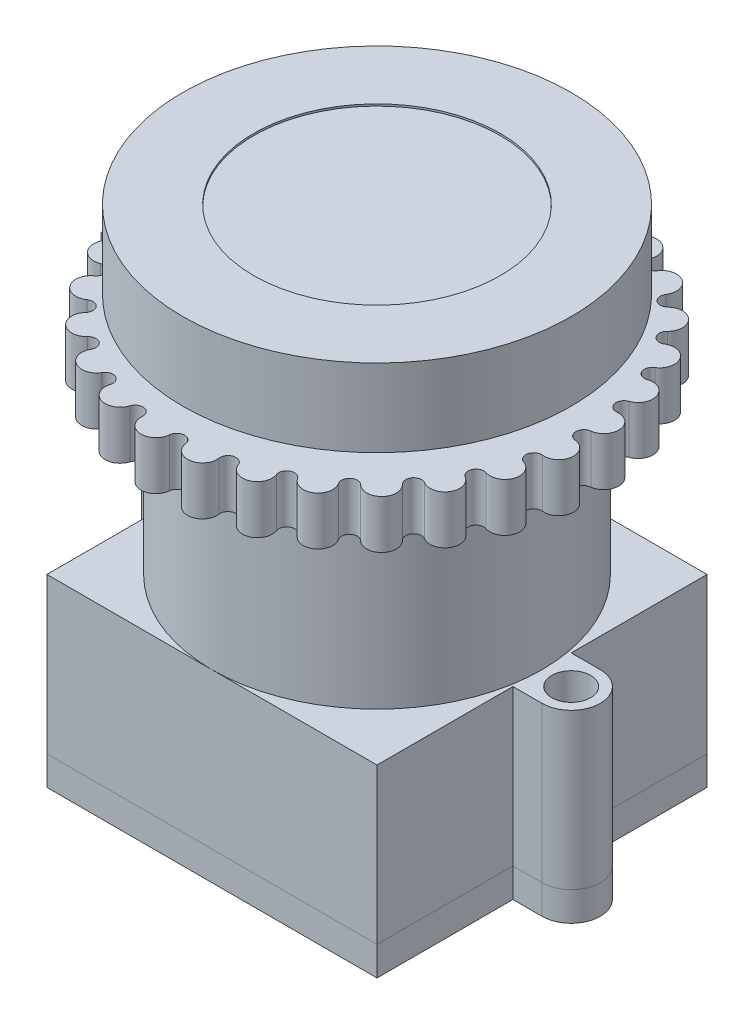
from build123d import *

# Parameters (mm, degrees)
BOSS_EXTRUDE1_DEPTH = 8
SKETCH3_R           = 8.500000018
BOSS_EXTRUDE2_DEPTH = 9
FILLET4_R           = 0.25
BOSS_EXTRUDE3_DEPTH = 2.5
SKETCH5_R           = 6.5
BOSS_EXTRUDE4_DEPTH = 1
SKETCH7_R           = 10
BOSS_EXTRUDE5_DEPTH = 4
SKETCH6_R           = 6.35
CUT_EXTRUDE2_DEPTH  = 0.1
BOSS_EXTRUDE6_DEPTH = 1.5
SKETCH2_R           = 1
CUT_EXTRUDE1_DEPTH  = 24.077752415


with BuildPart() as part:
    # Sketch1 → Boss-Extrude1 (new body)
    with BuildSketch(Plane(origin=(0, 0, 0), x_dir=(1, 0, 0), z_dir=(0, 1, 0))):
        with BuildLine():
            Line((8.500000018, -8.500000018), (8.500000018, -1.500000048))
            Line((8.500000018, -1.500000048), (10.000000066, -1.500000048))
            ThreePointArc((10.000000066, -1.500000048), (11.500000114, 0), (10.000000066, 1.500000048))
            Line((10.000000066, 1.500000048), (8.500000018, 1.500000048))
            Line((8.500000018, 1.500000048), (8.500000018, 8.500000018))
            Line((8.500000018, 8.500000018), (-8.500000018, 8.500000018))
            Line((-8.500000018, 8.500000018), (-8.500000018, 1.500000048))
            Line((-8.500000018, 1.500000048), (-10.000000066, 1.500000048))
            ThreePointArc((-10.000000066, 1.500000048), (-11.500000114, 0), (-10.000000066, -1.500000048))
            Line((-10.000000066, -1.500000048), (-8.500000018, -1.500000048))
            Line((-8.500000018, -1.500000048), (-8.500000018, -8.500000018))
            Line((-8.500000018, -8.500000018), (8.500000018, -8.500000018))
        make_face()
    extrude(amount=BOSS_EXTRUDE1_DEPTH)

    # Sketch3 → Boss-Extrude2 (add)
    with BuildSketch(Plane(origin=(0, 8, 0), x_dir=(1, 0, 0), z_dir=(0, 1, 0))):
        Circle(SKETCH3_R)
    extrude(amount=BOSS_EXTRUDE2_DEPTH)

    # Fillet4
    fillet4_edges = [part.edges().sort_by_distance(p)[0] for p in [
        (-8.500000018, 17, 0),
    ]]
    fillet(fillet4_edges, radius=FILLET4_R)

    # Sketch4 → Boss-Extrude3 (add)
    with BuildSketch(Plane(origin=(0, 17, 0), x_dir=(1, 0, 0), z_dir=(0, 1, 0))):
        with BuildLine():
            Line((-10.397042658, 3.347855978), (-10.861892381, 3.347855978))
            Line((-10.861892381, 3.347855978), (-10.861892381, -3.347855978))
            Line((-10.861892381, -3.347855978), (-10.397042658, -3.347855978))
            ThreePointArc((-10.397042658, -3.347855978), (-10.30482846, -3.409170816), (-10.325696234, -3.517925143))
            ThreePointArc((-10.325696234, -3.517925143), (-10.413698121, -4.478053525), (-9.490431715, -4.755848386))
            ThreePointArc((-9.490431715, -4.755848386), (-8.9781158, -4.935760929), (-9.10072321, -5.464725524))
            ThreePointArc((-9.10072321, -5.464725524), (-9.285999293, -6.526309611), (-8.224415206, -6.711585693))
            ThreePointArc((-8.224415206, -6.711585693), (-7.685190812, -6.775407106), (-7.689455387, -7.318378498))
            ThreePointArc((-7.689455387, -7.318378498), (-7.638692028, -8.394812928), (-6.562257599, -8.344049569))
            ThreePointArc((-6.562257599, -8.344049569), (-6.022097265, -8.288705798), (-5.907813595, -8.81953097))
            ThreePointArc((-5.907813595, -8.81953097), (-5.623455887, -9.858967689), (-4.584019167, -9.57460998))
            ThreePointArc((-4.584019167, -9.57460998), (-4.068940513, -9.402766741), (-3.841613241, -9.895877713))
            ThreePointArc((-3.841613241, -9.895877713), (-3.337357691, -10.848250718), (-2.384984686, -10.343995169))
            ThreePointArc((-2.384984686, -10.343995169), (-1.919797235, -10.063929543), (-1.590375914, -10.495574899))
            ThreePointArc((-1.590375914, -10.495574899), (-0.890510737, -11.315011738), (-0.071073897, -10.615146561))
            ThreePointArc((-0.071073897, -10.615146561), (0.321815911, -10.240348324), (0.737464217, -10.589737227))
            ThreePointArc((0.737464217, -10.589737227), (1.599228982, -11.236768515), (2.246260271, -10.375003749))
            ThreePointArc((2.246260271, -10.375003749), (2.547928318, -9.923525612), (3.029783294, -10.173829229))
            ThreePointArc((3.029783294, -10.173829229), (4.011939477, -10.61728975), (4.455399997, -9.635133567))
            ThreePointArc((4.455399997, -9.635133567), (4.651315997, -9.12872164), (5.176168388, -9.267883729))
            ThreePointArc((5.176168388, -9.267883729), (6.231408984, -9.486413552), (6.449938806, -8.431172955))
            ThreePointArc((6.449938806, -8.431172955), (6.530666175, -7.894219315), (7.07323569, -7.915536929))
            ThreePointArc((7.07323569, -7.915536929), (8.15073348, -7.898610241), (8.133806792, -6.821112451))
            ThreePointArc((8.133806792, -6.821112451), (8.095457176, -6.279480264), (8.629610154, -6.181926608))
            ThreePointArc((8.629610154, -6.181926608), (9.677465865, -5.93035871), (9.425897966, -4.882502998))
            ThreePointArc((9.425897966, -4.882502998), (9.270318533, -4.362280777), (9.770326707, -4.150554667))
            ThreePointArc((9.770326707, -4.150554667), (10.738068823, -3.676462697), (10.263976852, -2.70872058))
            ThreePointArc((10.263976852, -2.70872058), (9.998661313, -2.234965597), (10.440441051, -1.919265134))
            ThreePointArc((10.440441051, -1.919265134), (11.281456844, -1.245484431), (10.607676141, -0.404468638))
            ThreePointArc((10.607676141, -0.404468638), (10.245403812, 0), (10.607676141, 0.404468638))
            ThreePointArc((10.607676141, 0.404468638), (11.281456844, 1.245484431), (10.440441051, 1.919265134))
            ThreePointArc((10.440441051, 1.919265134), (9.998661313, 2.234965597), (10.263976852, 2.70872058))
            ThreePointArc((10.263976852, 2.70872058), (10.738068823, 3.676462697), (9.770326707, 4.150554667))
            ThreePointArc((9.770326707, 4.150554667), (9.270318533, 4.362280777), (9.425897966, 4.882502998))
            ThreePointArc((9.425897966, 4.882502998), (9.677465865, 5.93035871), (8.629610154, 6.181926608))
            ThreePointArc((8.629610154, 6.181926608), (8.095457176, 6.279480264), (8.133806792, 6.821112451))
            ThreePointArc((8.133806792, 6.821112451), (8.15073348, 7.898610241), (7.07323569, 7.915536929))
            ThreePointArc((7.07323569, 7.915536929), (6.530666175, 7.894219315), (6.449938806, 8.431172955))
            ThreePointArc((6.449938806, 8.431172955), (6.231408984, 9.486413552), (5.176168388, 9.267883729))
            ThreePointArc((5.176168388, 9.267883729), (4.651315997, 9.12872164), (4.455399997, 9.635133567))
            ThreePointArc((4.455399997, 9.635133567), (4.011939477, 10.61728975), (3.029783294, 10.173829229))
            ThreePointArc((3.029783294, 10.173829229), (2.547928318, 9.923525612), (2.246260271, 10.375003749))
            ThreePointArc((2.246260271, 10.375003749), (1.599228982, 11.236768515), (0.737464217, 10.589737227))
            ThreePointArc((0.737464217, 10.589737227), (0.321815911, 10.240348324), (-0.071073897, 10.615146561))
            ThreePointArc((-0.071073897, 10.615146561), (-0.890510737, 11.315011738), (-1.590375914, 10.495574899))
            ThreePointArc((-1.590375914, 10.495574899), (-1.919797235, 10.063929543), (-2.384984686, 10.343995169))
            ThreePointArc((-2.384984686, 10.343995169), (-3.337357691, 10.848250718), (-3.841613241, 9.895877713))
            ThreePointArc((-3.841613241, 9.895877713), (-4.068940513, 9.402766741), (-4.584019167, 9.57460998))
            ThreePointArc((-4.584019167, 9.57460998), (-5.623455887, 9.858967689), (-5.907813595, 8.81953097))
            ThreePointArc((-5.907813595, 8.81953097), (-6.022097265, 8.288705798), (-6.562257599, 8.344049569))
            ThreePointArc((-6.562257599, 8.344049569), (-7.638692028, 8.394812928), (-7.689455387, 7.318378498))
            ThreePointArc((-7.689455387, 7.318378498), (-7.685190812, 6.775407106), (-8.224415206, 6.711585693))
            ThreePointArc((-8.224415206, 6.711585693), (-9.285999293, 6.526309611), (-9.10072321, 5.464725524))
            ThreePointArc((-9.10072321, 5.464725524), (-8.9781158, 4.935760929), (-9.490431715, 4.755848386))
            ThreePointArc((-9.490431715, 4.755848386), (-10.413698121, 4.478053525), (-10.325696234, 3.517925143))
            ThreePointArc((-10.325696234, 3.517925143), (-10.30482846, 3.409170816), (-10.397042658, 3.347855978))
        make_face()
    extrude(amount=BOSS_EXTRUDE3_DEPTH)

    # Sketch5 → Boss-Extrude4 (add)
    with BuildSketch(Plane(origin=(0, 19.5, 0), x_dir=(1, 0, 0), z_dir=(0, 1, 0))):
        Circle(SKETCH5_R)
    extrude(amount=BOSS_EXTRUDE4_DEPTH)

    # Sketch7 → Boss-Extrude5 (add)
    with BuildSketch(Plane(origin=(0, 20.5, 0), x_dir=(1, 0, 0), z_dir=(0, 1, 0))):
        Circle(SKETCH7_R)
    extrude(amount=BOSS_EXTRUDE5_DEPTH)

    # Sketch6 → Cut-Extrude2 (cut)
    with BuildSketch(Plane(origin=(0, 24.5, 0), x_dir=(1, 0, 0), z_dir=(0, 1, 0))):
        Circle(SKETCH6_R)
    extrude(amount=-CUT_EXTRUDE2_DEPTH, mode=Mode.SUBTRACT)


with BuildPart() as body_2:
    # Sketch8 → Boss-Extrude6 (new body)
    with BuildSketch(Plane.XZ):
        with BuildLine():
            Line((-8.500000018, -1.500000048), (-8.500000018, -8.500000018))
            Line((-8.500000018, -8.500000018), (8.500000018, -8.500000018))
            Line((8.500000018, -8.500000018), (8.500000018, -1.500000048))
            Line((8.500000018, -1.500000048), (10.000000066, -1.500000048))
            ThreePointArc((10.000000066, -1.500000048), (11.500000114, 0), (10.000000066, 1.500000048))
            Line((10.000000066, 1.500000048), (8.500000018, 1.500000048))
            Line((8.500000018, 1.500000048), (8.500000018, 8.500000018))
            Line((8.500000018, 8.500000018), (-8.500000018, 8.500000018))
            Line((-8.500000018, 8.500000018), (-8.500000018, 1.500000048))
            Line((-8.500000018, 1.500000048), (-10.000000066, 1.500000048))
            ThreePointArc((-10.000000066, 1.500000048), (-11.500000114, 0), (-10.000000066, -1.500000048))
            Line((-10.000000066, -1.500000048), (-8.500000018, -1.500000048))
        make_face()
    extrude(amount=BOSS_EXTRUDE6_DEPTH)


with BuildPart() as cut_extrude1_tool:
    # Sketch2 → Cut-Extrude1 (new, through all)
    with BuildSketch(Plane(origin=(0, 8, 0), x_dir=(1, 0, 0), z_dir=(0, 1, 0))):
        with Locations((-10.000000066, 0)):
            Circle(SKETCH2_R)
        with Locations((10.000000066, 0)):
            Circle(SKETCH2_R)
    extrude(amount=-CUT_EXTRUDE1_DEPTH)


with BuildPart() as part_1:
    add(part.part)

    # Cut-Extrude1: cut by cut_extrude1_tool
    add(cut_extrude1_tool.part, mode=Mode.SUBTRACT)


with BuildPart() as body_2_1:
    add(body_2.part)

    # Cut-Extrude1: cut by cut_extrude1_tool
    add(cut_extrude1_tool.part, mode=Mode.SUBTRACT)


solid = Compound([part_1.part, body_2_1.part])
